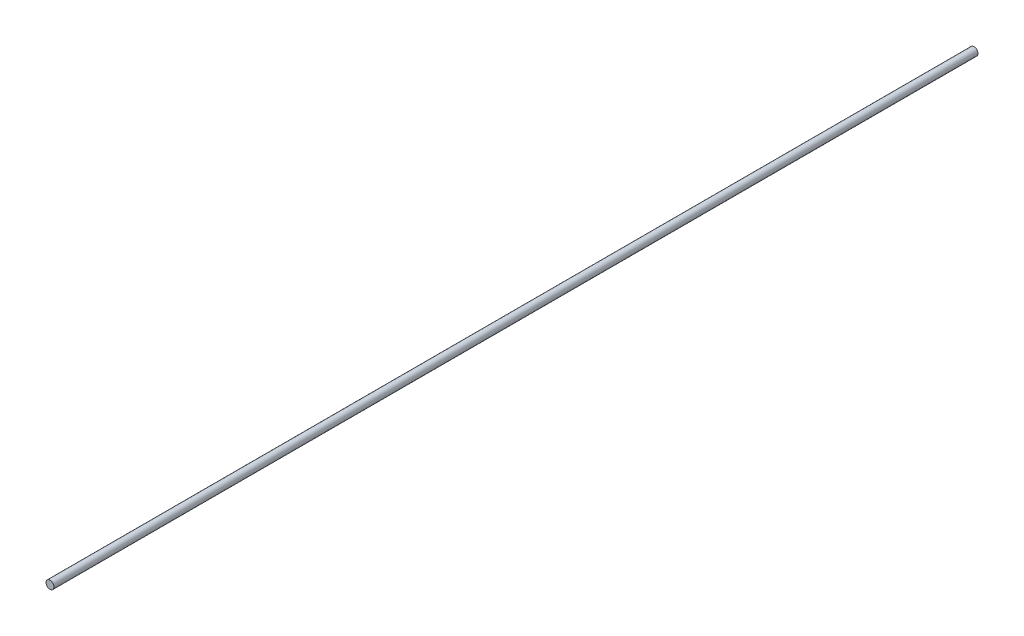
from build123d import *

# Parameters (mm, degrees)
SKETCH_1_R = 0.4
D0P8_DEPTH = 93.353761984


with BuildPart() as part:
    # 草图1 → D0p8钢索直线跨度 (new body)
    with BuildSketch(Plane.XY):
        Circle(SKETCH_1_R)
    extrude(amount=D0P8_DEPTH)


solid = part.part
